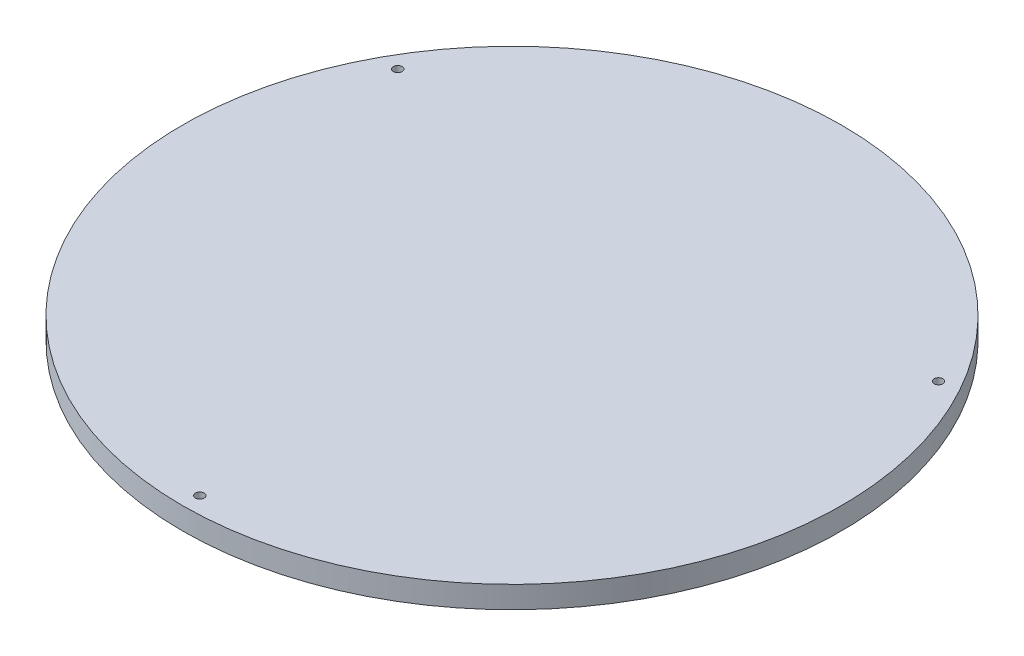
from build123d import *

# Parameters (mm, degrees)
SKETCH1_R           = 150
BOSS_EXTRUDE1_DEPTH = 10
SKETCH2_R           = 2
CUT_EXTRUDE1_DEPTH  = 10


with BuildPart() as part:
    # Sketch1 → Boss-Extrude1 (new body)
    with BuildSketch(Plane(origin=(0, 0, 0), x_dir=(1, 0, 0), z_dir=(0, 1, 0))):
        with Locations(Location((0, 0, 0), (0, 0, 270))):
            Circle(SKETCH1_R)
    extrude(amount=BOSS_EXTRUDE1_DEPTH)

    # Sketch2 → Cut-Extrude1 (cut)
    with BuildSketch(Plane(origin=(0, 10, 0), x_dir=(1, 0, 0), z_dir=(0, 1, 0))):
        with Locations(Location((-123.062136008, 71.049957351, 0), (0, 0, 270))):
            Circle(SKETCH2_R)
        with Locations(Location((123.062136008, 71.049957351, 0), (0, 0, 270))):
            Circle(SKETCH2_R)
        with Locations(Location((0, -142.099914702, 0), (0, 0, 270))):
            Circle(SKETCH2_R)
    extrude(amount=-CUT_EXTRUDE1_DEPTH, mode=Mode.SUBTRACT)


solid = part.part
